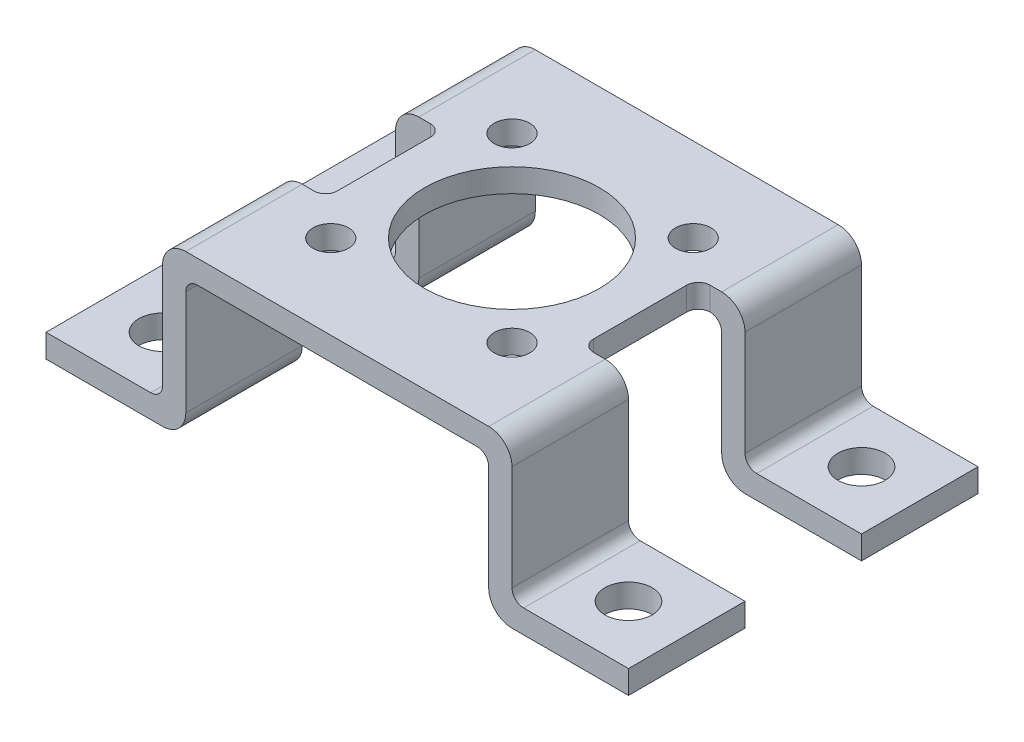
from build123d import *

# Parameters (mm, degrees)
SKETCH1_W           = 30
SKETCH1_H           = 30
SKETCH1_R           = 7.5
SKETCH1_R_2         = 1.525
BOSS_EXTRUDE1_DEPTH = 2
SKETCH3_W           = 2
SKETCH3_H           = 10
BOSS_EXTRUDE2_DEPTH = 10
SKETCH4_W           = 12
SKETCH4_H           = 10
SKETCH4_R           = 2.025
BOSS_EXTRUDE3_DEPTH = 2
SKETCH5_W           = 4
SKETCH5_H           = 10
CUT_EXTRUDE1_DEPTH  = 32.527765541
FILLET1_R           = 2
FILLET2_R           = 1
FILLET3_R           = 1


with BuildPart() as part:
    # Sketch1 → Boss-Extrude1 (new body)
    with BuildSketch(Plane(origin=(0, 0, 0), x_dir=(1, 0, 0), z_dir=(0, 1, 0))):
        Rectangle(SKETCH1_W, SKETCH1_H)
        with Locations(Location((0, 0, 0), (0, 0, 270))):
            Circle(SKETCH1_R, mode=Mode.SUBTRACT)
        with Locations(Location((-7.778174593, 7.778174593, 0), (0, 0, 270))):
            Circle(SKETCH1_R_2, mode=Mode.SUBTRACT)
        with Locations(Location((7.778174593, 7.778174593, 0), (0, 0, 270))):
            Circle(SKETCH1_R_2, mode=Mode.SUBTRACT)
        with Locations(Location((-7.778174593, -7.778174593, 0), (0, 0, 270))):
            Circle(SKETCH1_R_2, mode=Mode.SUBTRACT)
        with Locations(Location((7.778174593, -7.778174593, 0), (0, 0, 270))):
            Circle(SKETCH1_R_2, mode=Mode.SUBTRACT)
    extrude(amount=BOSS_EXTRUDE1_DEPTH)

    # Sketch3 → Boss-Extrude2 (add)
    with BuildSketch(Plane.XZ):
        with Locations((-14, 10)):
            Rectangle(SKETCH3_W, SKETCH3_H)
        with Locations((14, 10)):
            Rectangle(SKETCH3_W, SKETCH3_H)
        with Locations((14, -10)):
            Rectangle(SKETCH3_W, SKETCH3_H)
        with Locations((-14, -10)):
            Rectangle(SKETCH3_W, SKETCH3_H)
    extrude(amount=BOSS_EXTRUDE2_DEPTH)

    # Sketch4 → Boss-Extrude3 (add)
    # profile 1 of 4: a face of its own
    with BuildSketch(Plane.XZ.offset(10)):
        with Locations((-19, 10)):
            Rectangle(SKETCH4_W, SKETCH4_H)
        with Locations(Location((-20, 10, 0), (0, 0, 270))):
            Circle(SKETCH4_R, mode=Mode.SUBTRACT)
    # profile 2 of 4: a face of its own
    with BuildSketch(Plane.XZ.offset(10)):
        with Locations((19, 10)):
            Rectangle(SKETCH4_W, SKETCH4_H)
        with Locations(Location((20, 10, 0), (0, 0, 90))):
            Circle(SKETCH4_R, mode=Mode.SUBTRACT)
    # profile 3 of 4: a face of its own
    with BuildSketch(Plane.XZ.offset(10)):
        with Locations((19, -10)):
            Rectangle(SKETCH4_W, SKETCH4_H)
        with Locations(Location((20, -10, 0), (0, 0, 270))):
            Circle(SKETCH4_R, mode=Mode.SUBTRACT)
    # profile 4 of 4: a face of its own
    with BuildSketch(Plane.XZ.offset(10)):
        with Locations((-19, -10)):
            Rectangle(SKETCH4_W, SKETCH4_H)
        with Locations(Location((-20, -10, 0), (0, 0, 90))):
            Circle(SKETCH4_R, mode=Mode.SUBTRACT)
    extrude(amount=BOSS_EXTRUDE3_DEPTH)

    # Sketch5 → Cut-Extrude1 (cut, through all)
    with BuildSketch(Plane.XZ):
        with Locations((-13, 0)):
            Rectangle(SKETCH5_W, SKETCH5_H)
        with Locations((13, 0)):
            Rectangle(SKETCH5_W, SKETCH5_H)
    extrude(amount=-CUT_EXTRUDE1_DEPTH, mode=Mode.SUBTRACT)

    # Fillet1
    fillet1_edges = [part.edges().sort_by_distance(p)[0] for p in [
        (13, -12, -10),
        (-13, -12, -10),
        (-15, 2, -10),
        (-15, 2, 10),
        (15, 2, -10),
        (15, 2, 10),
        (-13, -12, 10),
        (13, -12, 10),
    ]]
    fillet(fillet1_edges, radius=FILLET1_R)

    # Fillet2
    fillet2_edges = [part.edges().sort_by_distance(p)[0] for p in [
        (-13, 0, 10),
        (-15, -10, 10),
        (13, 0, 10),
        (15, -10, 10),
        (13, 0, -10),
        (15, -10, -10),
        (-13, 0, -10),
        (-15, -10, -10),
    ]]
    fillet(fillet2_edges, radius=FILLET2_R)

    # Fillet3
    fillet3_edges = [part.edges().sort_by_distance(p)[0] for p in [
        (-11, 1, -5),
        (11, 1, -5),
        (11, 1, 5),
        (-11, 1, 5),
    ]]
    fillet(fillet3_edges, radius=FILLET3_R)


solid = part.part
